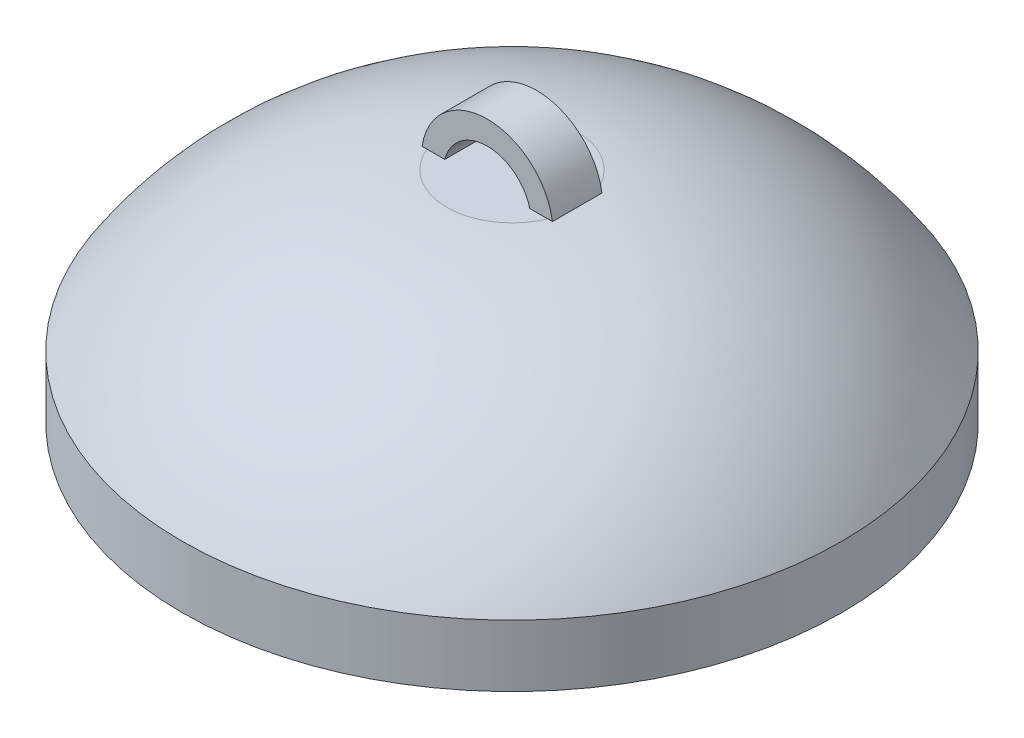
from build123d import *

# Parameters (mm, degrees)
RESSALTO_EXTRUS_O1_DEPTH = 6


with BuildPart() as part:
    # Esboço1 → Revolução1 (revolve)
    with BuildSketch(Plane.XY, mode=Mode.PRIVATE) as revolu_o1_sk:
        with BuildLine():
            Line((-80, 0), (-72.5, 0))
            Line((-72.5, 0), (-72.5, 5))
            Line((-72.5, 5), (-67.5, 5))
            Line((-67.5, 5), (-67.5, 0))
            Line((-67.5, 0), (-60, 0))
            Line((-60, 0), (-60, 15))
            ThreePointArc((-60, 15), (-39.11072253, 31.653079881), (-13.733254033, 40))
            Line((-13.733254033, 40), (0, 40))
            Line((0, 40), (0, 53.104839013))
            Line((0, 53.104839013), (-15.816514793, 53.104839013))
            ThreePointArc((-15.816514793, 53.104839013), (-52.396597301, 41.612543242), (-80, 15))
            Line((-80, 15), (-80, 0))
        make_face()
    revolve(revolu_o1_sk.sketch.rotate(Axis((0, 0, 0), (0, 1, 0)), 270), axis=Axis((0, 0, 0), (0, 1, 0)))

    # Esboço2 → Ressalto-extrusão1 (add, symmetric)
    with BuildSketch(Plane.XY):
        with BuildLine():
            Line((15.816514793, 53.104839013), (10.316514793, 53.104839013))
            ThreePointArc((10.316514793, 53.104839013), (0, 61.065494668), (-10.316514793, 53.104839013))
            Line((-10.316514793, 53.104839013), (-15.816514793, 53.104839013))
            ThreePointArc((-15.816514793, 53.104839013), (0, 66.754458801), (15.816514793, 53.104839013))
        make_face()
    extrude(amount=RESSALTO_EXTRUS_O1_DEPTH, both=True)


solid = part.part
